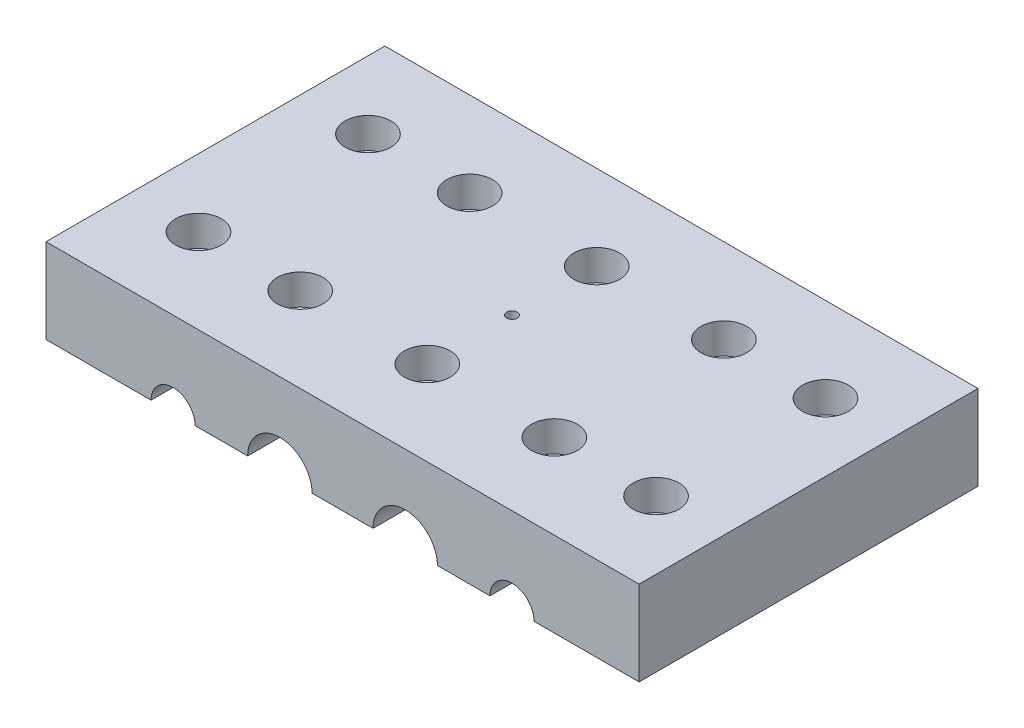
from build123d import *

# Parameters (mm, degrees)
SKETCH1_W           = 88.9
SKETCH1_H           = 50.8
BOSS_EXTRUDE1_DEPTH = 12.7
SKETCH2_R           = 3.429
SKETCH2_R_2         = 2.286
CUT_EXTRUDE1_DEPTH  = 4.572
SKETCH3_R           = 2.286
CUT_EXTRUDE2_DEPTH  = 53.74706153
LPATTERN1_COUNT     = 2
LPATTERN1_PITCH     = 25.4
CUT_EXTRUDE3_DEPTH  = 69.685751798
SKETCH5_R           = 0.7874
CUT_EXTRUDE4_DEPTH  = 53.74706153
SKETCH6_R           = 2.286
CUT_EXTRUDE5_DEPTH  = 53.74706153


with BuildPart() as part:
    # Sketch1 → Boss-Extrude1 (new body)
    with BuildSketch(Plane(origin=(0, 0, 0), x_dir=(1, 0, 0), z_dir=(0, 1, 0))):
        Rectangle(SKETCH1_W, SKETCH1_H)
    extrude(amount=BOSS_EXTRUDE1_DEPTH)

    # Sketch2 → Cut-Extrude1 (cut)
    # profile 1 of 5: a face of its own
    with BuildSketch(Plane(origin=(0, 12.7, 0), x_dir=(1, 0, 0), z_dir=(0, 1, 0))):
        with Locations(Location((-34.29, 12.7, 0), (0, 0, 270))):
            Circle(SKETCH2_R)
        with Locations(Location((-34.29, 12.7, 0), (0, 0, 270))):
            Circle(SKETCH2_R_2, mode=Mode.SUBTRACT)
    # profile 2 of 5: a face of its own
    with BuildSketch(Plane(origin=(0, 12.7, 0), x_dir=(1, 0, 0), z_dir=(0, 1, 0))):
        with Locations(Location((-19.05, 12.7, 0), (0, 0, 270))):
            Circle(SKETCH2_R)
        with Locations(Location((-19.05, 12.7, 0), (0, 0, 270))):
            Circle(SKETCH2_R_2, mode=Mode.SUBTRACT)
    # profile 3 of 5: a face of its own
    with BuildSketch(Plane(origin=(0, 12.7, 0), x_dir=(1, 0, 0), z_dir=(0, 1, 0))):
        with Locations(Location((0, 12.7, 0), (0, 0, 270))):
            Circle(SKETCH2_R)
        with Locations(Location((0, 12.7, 0), (0, 0, 270))):
            Circle(SKETCH2_R_2, mode=Mode.SUBTRACT)
    # profile 4 of 5: a face of its own
    with BuildSketch(Plane(origin=(0, 12.7, 0), x_dir=(1, 0, 0), z_dir=(0, 1, 0))):
        with Locations(Location((19.05, 12.7, 0), (0, 0, 270))):
            Circle(SKETCH2_R)
        with Locations(Location((19.05, 12.7, 0), (0, 0, 270))):
            Circle(SKETCH2_R_2, mode=Mode.SUBTRACT)
    # profile 5 of 5: a face of its own
    with BuildSketch(Plane(origin=(0, 12.7, 0), x_dir=(1, 0, 0), z_dir=(0, 1, 0))):
        with Locations(Location((34.29, 12.7, 0), (0, 0, 270))):
            Circle(SKETCH2_R)
        with Locations(Location((34.29, 12.7, 0), (0, 0, 270))):
            Circle(SKETCH2_R_2, mode=Mode.SUBTRACT)
    cut_extrude1 = extrude(amount=-CUT_EXTRUDE1_DEPTH, mode=Mode.SUBTRACT)

    # Sketch3 → Cut-Extrude2 (cut, through all)
    with BuildSketch(Plane(origin=(0, 12.7, 0), x_dir=(1, 0, 0), z_dir=(0, 1, 0))):
        with Locations(Location((-34.29, 12.7, 0), (0, 0, 270))):
            Circle(SKETCH3_R)
        with Locations(Location((-19.05, 12.7, 0), (0, 0, 270))):
            Circle(SKETCH3_R)
        with Locations(Location((0, 12.7, 0), (0, 0, 270))):
            Circle(SKETCH3_R)
        with Locations(Location((19.05, 12.7, 0), (0, 0, 270))):
            Circle(SKETCH3_R)
        with Locations(Location((34.29, 12.7, 0), (0, 0, 270))):
            Circle(SKETCH3_R)
    extrude(amount=-CUT_EXTRUDE2_DEPTH, mode=Mode.SUBTRACT)

    # LPattern1: Cut-Extrude1 ×2
    with Locations(*[(0, 0, i * LPATTERN1_PITCH) for i in range(1, LPATTERN1_COUNT)]):
        add(cut_extrude1, mode=Mode.SUBTRACT)

    # Sketch4 → Cut-Extrude3 (cut, through all)
    with BuildSketch(Plane.XY.offset(25.4)):
        with BuildLine():
            Line((-28.702, 0), (-22.098, 0))
            ThreePointArc((-22.098, 0), (-25.4, 3.302), (-28.702, 0))
        make_face()
        with BuildLine():
            Line((-14.224, 0), (-4.572, 0))
            ThreePointArc((-4.572, 0), (-9.398, 4.826), (-14.224, 0))
        make_face()
        with BuildLine():
            Line((4.572, 0), (14.224, 0))
            ThreePointArc((14.224, 0), (9.398, 4.826), (4.572, 0))
        make_face()
        with BuildLine():
            Line((22.098, 0), (28.702, 0))
            ThreePointArc((28.702, 0), (25.4, 3.302), (22.098, 0))
        make_face()
    extrude(amount=-CUT_EXTRUDE3_DEPTH, mode=Mode.SUBTRACT)

    # Sketch5 → Cut-Extrude4 (cut, through all)
    with BuildSketch(Plane(origin=(0, 12.7, 0), x_dir=(1, 0, 0), z_dir=(0, 1, 0))):
        with Locations(Location((0, 0, 0), (0, 0, 270))):
            Circle(SKETCH5_R)
    extrude(amount=-CUT_EXTRUDE4_DEPTH, mode=Mode.SUBTRACT)

    # Sketch6 → Cut-Extrude5 (cut, through all)
    with BuildSketch(Plane(origin=(0, 12.7, 0), x_dir=(1, 0, 0), z_dir=(0, 1, 0))):
        with Locations(Location((-34.29, -12.7, 0), (0, 0, 270))):
            Circle(SKETCH6_R)
        with Locations(Location((-19.05, -12.7, 0), (0, 0, 270))):
            Circle(SKETCH6_R)
        with Locations(Location((0, -12.7, 0), (0, 0, 270))):
            Circle(SKETCH6_R)
        with Locations(Location((19.05, -12.7, 0), (0, 0, 270))):
            Circle(SKETCH6_R)
        with Locations(Location((34.29, -12.7, 0), (0, 0, 270))):
            Circle(SKETCH6_R)
    extrude(amount=-CUT_EXTRUDE5_DEPTH, mode=Mode.SUBTRACT)


solid = part.part
